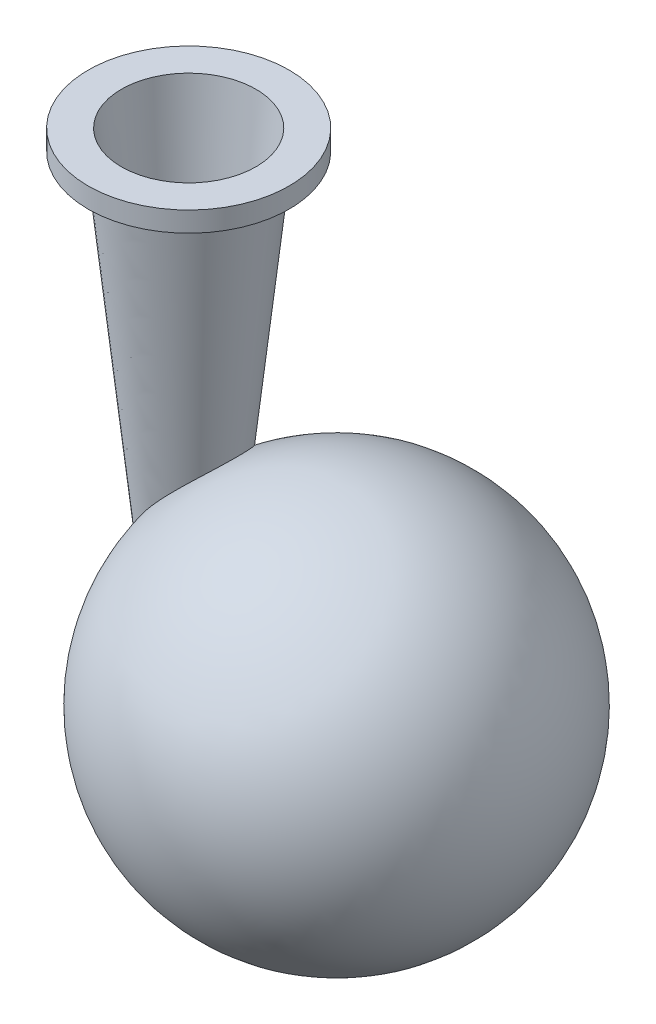
from build123d import *

# Parameters (mm, degrees)
EXTRUDE_5_REACH      = 191.138
EXTRUDE_5_END_RADIUS = 48
EXTRUDE_START        = 106
SKETCH_6_R           = 18.746212634
EXTRUDE_5_START      = 106
EXTRUDE_5_DRAFT      = -6
SHELL_2_T            = -2
SKETCH_7_R           = 25
SKETCH_7_R_2         = 16.735196074
EXTRUDE_6_DEPTH      = 5


with BuildPart() as part:
    # 草图5 → 旋转8 (revolve)
    with BuildSketch(Plane.XY):
        with BuildLine():
            Line((0, 48), (0, -48))
            ThreePointArc((0, -48), (48, 0), (0, 48))
        make_face()
    revolve(axis=Axis((0, 48, 0), (0, -1, 0)))

    # 凸台-拉伸5: up to this sphere (the profile starts outside it)
    extrude_5_end = Location((0, 0, 0)) * Sphere(EXTRUDE_5_END_RADIUS, mode=Mode.PRIVATE)



with BuildPart() as extrude_5_long_prism_1:
    # 草图6 → 凸台-拉伸5 (the long prism of profile 1, to be tilted and cut off)
    with BuildSketch(Plane(origin=(0, 0, 0), x_dir=(1, 0, 0), z_dir=(0, 1, 0)).offset(EXTRUDE_START)):
        with Locations((-36.793445322, 0)):
            Circle(SKETCH_6_R)
    extrude(amount=-EXTRUDE_5_REACH)
    extrude_5_tool1_sides = [extrude_5_long_prism_1.faces().sort_by_distance(p)[0] for p in [
        (-55.539657956, 10.431, 0),
    ]]
    draft(extrude_5_tool1_sides, Plane(origin=(0, 0, 0), x_dir=(1, 0, 0), z_dir=(0, 1, 0)).offset(EXTRUDE_5_START), EXTRUDE_5_DRAFT)  # the draft: side faces tilted about the start plane


with BuildPart() as part_1:
    add(part.part)
    extrude_5_tool1 = extrude_5_long_prism_1.part - extrude_5_end
    add(extrude_5_tool1.solids().sort_by_distance((-36.793445, 106, 0))[0])

    # 抽壳2
    shell_2_openings = [part_1.faces().sort_by_distance(p)[0] for p in [
        (-36.793445322, 106, 0),
    ]]
    offset(amount=SHELL_2_T, openings=shell_2_openings, kind=Kind.INTERSECTION)

    # 草图7 → 凸台-拉伸6 (add)
    with BuildSketch(Plane(origin=(0, 106, 0), x_dir=(1, 0, 0), z_dir=(0, 1, 0))):
        with Locations((-36.793445322, 0)):
            Circle(SKETCH_7_R)
        with Locations((-36.793445322, 0)):
            Circle(SKETCH_7_R_2, mode=Mode.SUBTRACT)
    extrude(amount=-EXTRUDE_6_DEPTH)


solid = part_1.part
